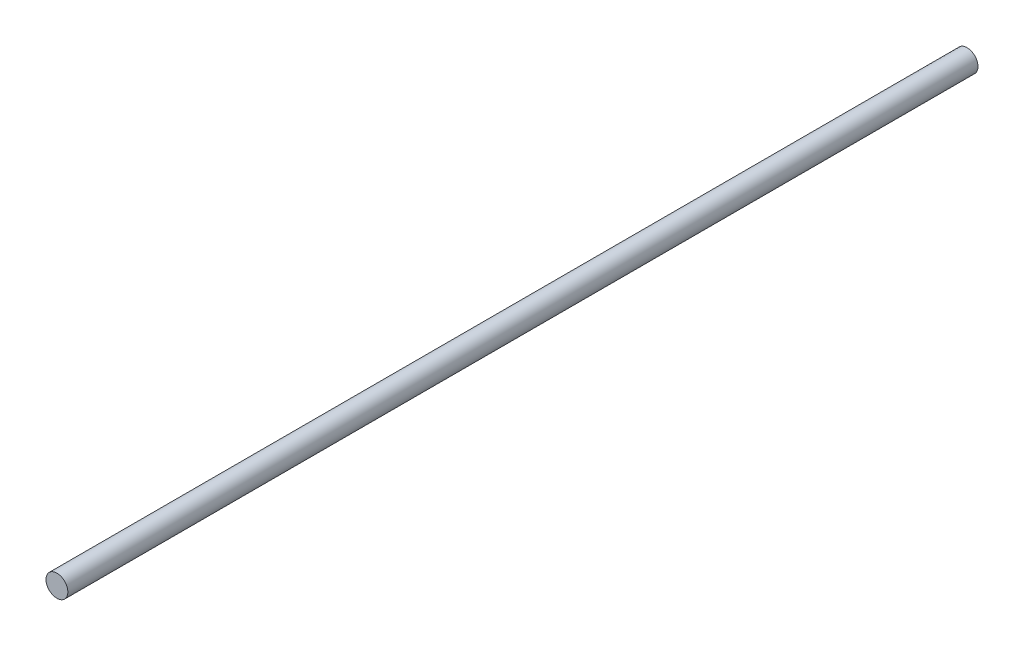
from build123d import *

# Parameters (mm, degrees)
ESBO_O1_R                = 6
RESSALTO_EXTRUS_O1_DEPTH = 500


with BuildPart() as part:
    # Esboço1 → Ressalto-extrusão1 (new body)
    with BuildSketch(Plane.XY):
        Circle(ESBO_O1_R)
    extrude(amount=RESSALTO_EXTRUS_O1_DEPTH)


solid = part.part
